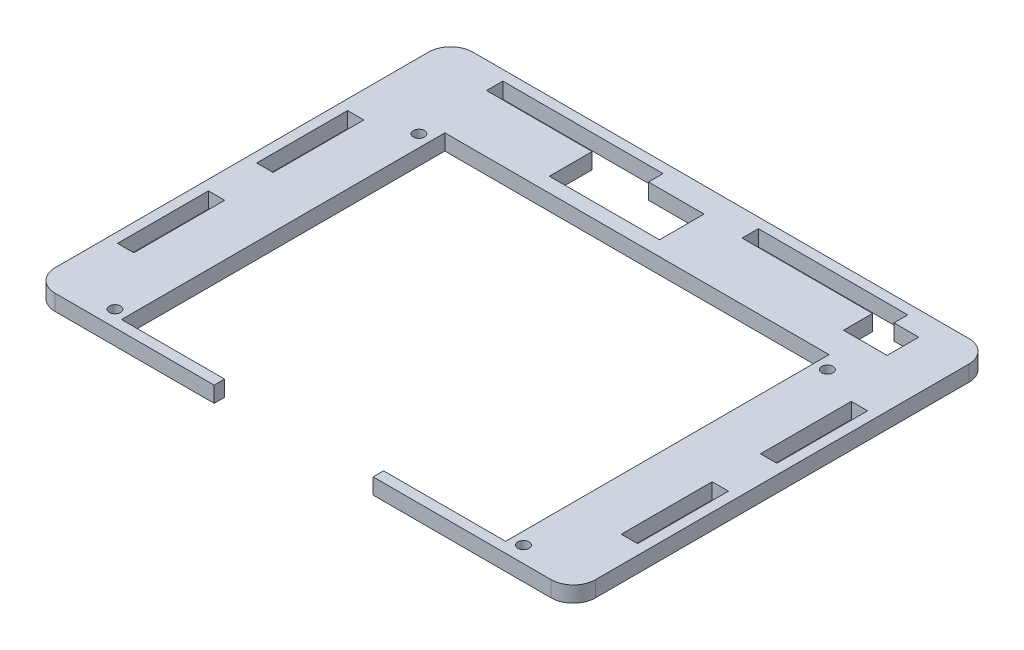
from build123d import *

# Parameters (mm, degrees)
SKETCH1_R           = 1.1303
SKETCH1_W           = 3.2766
SKETCH1_H           = 18.2372
BOSS_EXTRUDE1_DEPTH = 1.5875
FILLET1_R           = 4.445
SKETCH2_W           = 81.9912
SKETCH2_H           = 2.0955
BOSS_EXTRUDE2_DEPTH = 3.175
SKETCH3_W           = 31.9024
SKETCH3_H           = 2.0955
CUT_EXTRUDE1_DEPTH  = 3.175


with BuildPart() as part:
    # Sketch1 → Boss-Extrude1 (new, symmetric)
    with BuildSketch(Plane(origin=(0, 0, 0), x_dir=(1, 0, 0), z_dir=(0, 1, 0))):
        Polygon((-38.5572, -41.9227), (-38.5572, 25.0825), (38.5572, 25.0825), (38.5572, -41.9227), (54.229, -41.9227), (54.229, 41.9227), (-54.229, 41.9227), (-54.229, -41.9227), align=None)
        with Locations(Location((-40.9956, -38.6969, 0), (0, 0, 270))):
            Circle(SKETCH1_R, mode=Mode.SUBTRACT)
        with Locations(Location((-40.9956, 22.3139, 0), (0, 0, 270))):
            Circle(SKETCH1_R, mode=Mode.SUBTRACT)
        with Locations(Location((40.9956, 22.3139, 0), (0, 0, 270))):
            Circle(SKETCH1_R, mode=Mode.SUBTRACT)
        with Locations(Location((40.9956, -38.6969, 0), (0, 0, 270))):
            Circle(SKETCH1_R, mode=Mode.SUBTRACT)
        with Locations((-50.5587, 10.0711)):
            Rectangle(SKETCH1_W, SKETCH1_H, mode=Mode.SUBTRACT)
        with Locations((-50.5587, -17.8689)):
            Rectangle(SKETCH1_W, SKETCH1_H, mode=Mode.SUBTRACT)
        with Locations((50.5587, -17.8689)):
            Rectangle(SKETCH1_W, SKETCH1_H, mode=Mode.SUBTRACT)
        with Locations((50.5587, 10.0711)):
            Rectangle(SKETCH1_W, SKETCH1_H, mode=Mode.SUBTRACT)
        Polygon((-20.5232, 36.6141), (-41.7322, 36.6141), (-41.7322, 39.8907), (-9.5758, 39.8907), (-9.5758, 37.2237), (-9.5758, 36.9697), (1.5748, 36.9697), (1.5748, 28.0289), (-20.5232, 28.0289), align=None, mode=Mode.SUBTRACT)
        Polygon((9.5758, 38.590972839), (9.5758, 39.8907), (39.5478, 39.8907), (39.5478, 37.1221), (44.5262, 37.1221), (44.5262, 30.7721), (35.7632, 30.7721), (35.7632, 36.6141), (9.5758, 36.6141), align=None, mode=Mode.SUBTRACT)
    extrude(amount=BOSS_EXTRUDE1_DEPTH, both=True)

    # Fillet1
    fillet1_edges = [part.edges().sort_by_distance(p)[0] for p in [
        (-54.229, 0, -41.9227),
        (54.229, 0, -41.9227),
        (54.229, 0, 41.9227),
        (-54.229, 0, 41.9227),
    ]]
    fillet(fillet1_edges, radius=FILLET1_R)

    # Sketch2 → Boss-Extrude2 (add)
    with BuildSketch(Plane(origin=(0, 1.5875, 0), x_dir=(1, 0, 0), z_dir=(0, 1, 0))):
        with Locations((0, -40.87495)):
            Rectangle(SKETCH2_W, SKETCH2_H)
    extrude(amount=-BOSS_EXTRUDE2_DEPTH)

    # Sketch3 → Cut-Extrude1 (cut)
    with BuildSketch(Plane(origin=(0, 1.5875, 0), x_dir=(1, 0, 0), z_dir=(0, 1, 0))):
        with Locations((-1.905, -40.87495)):
            Rectangle(SKETCH3_W, SKETCH3_H)
    extrude(amount=-CUT_EXTRUDE1_DEPTH, mode=Mode.SUBTRACT)


solid = part.part
